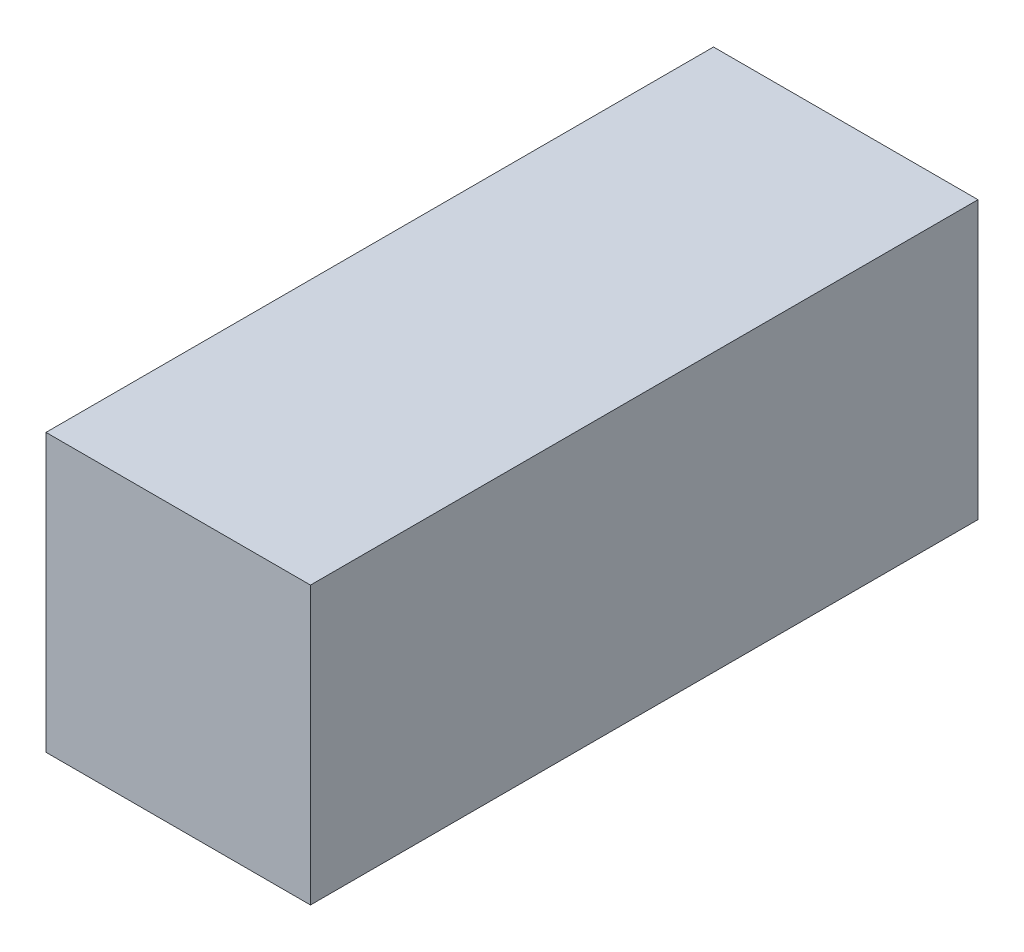
from build123d import *

# Parameters (mm, degrees)
SKETCH1_W           = 21
SKETCH1_H           = 53
BOSS_EXTRUDE1_DEPTH = 22


with BuildPart() as part:
    # Sketch1 → Boss-Extrude1 (new body)
    with BuildSketch(Plane(origin=(0, 0, 0), x_dir=(1, 0, 0), z_dir=(0, 1, 0))):
        with Locations((10.5, -26.5)):
            Rectangle(SKETCH1_W, SKETCH1_H)
    extrude(amount=BOSS_EXTRUDE1_DEPTH)


solid = part.part
